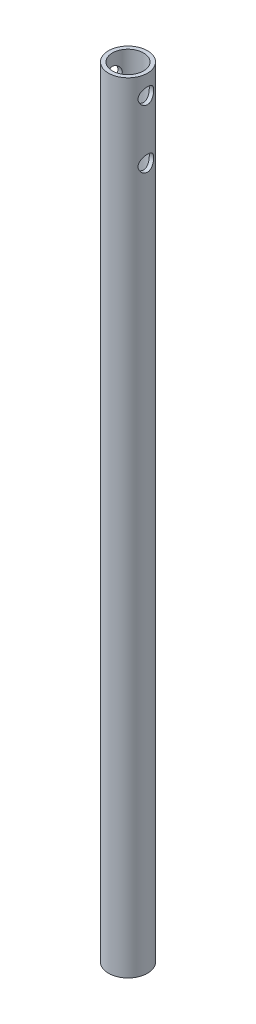
from build123d import *

# Parameters (mm, degrees)
SKETCH_2_R          = 3
SKETCH_2_R_2        = 1.5
EXTRUDE_1_DEPTH     = 200
SKETCH_3_R          = 5
EXTRUDE_2_DEPTH     = 200
SKETCH_4_R          = 4
CUT_EXTRUDE_1_DEPTH = 200
SKETCH_5_R          = 2
CUT_EXTRUDE_5_DEPTH = 100


with BuildPart() as part:
    # 草图2 → 凸台-拉伸1 (new body)
    with BuildSketch(Plane(origin=(0, 0, 0), x_dir=(1, 0, 0), z_dir=(0, 1, 0))):
        with Locations(Location((0, 0, 0), (0, 0, 270))):
            Circle(SKETCH_2_R)
        with Locations(Location((0, 0, 0), (0, 0, 270))):
            Circle(SKETCH_2_R_2, mode=Mode.SUBTRACT)
    extrude(amount=EXTRUDE_1_DEPTH)

    # 草图3 → 凸台-拉伸2 (add)
    with BuildSketch(Plane(origin=(0, 200, 0), x_dir=(1, 0, 0), z_dir=(0, 1, 0))):
        with Locations(Location((0, 0, 0), (0, 0, 270))):
            Circle(SKETCH_3_R)
    extrude(amount=-EXTRUDE_2_DEPTH)

    # 草图4 → 切除-拉伸1 (cut)
    with BuildSketch(Plane(origin=(0, 200, 0), x_dir=(1, 0, 0), z_dir=(0, 1, 0))):
        with Locations(Location((0, 0, 0), (0, 0, 270))):
            Circle(SKETCH_4_R)
    extrude(amount=-CUT_EXTRUDE_1_DEPTH, mode=Mode.SUBTRACT)

    # 草图5 → 切除-拉伸5 (cut, symmetric)
    with BuildSketch(Plane(origin=(0, 0, 0), x_dir=(0, 0, -1), z_dir=(1, 0, 0))):
        with Locations((0, 195)):
            Circle(SKETCH_5_R)
        with Locations((0, 180)):
            Circle(SKETCH_5_R)
    extrude(amount=CUT_EXTRUDE_5_DEPTH, both=True, mode=Mode.SUBTRACT)


solid = part.part
